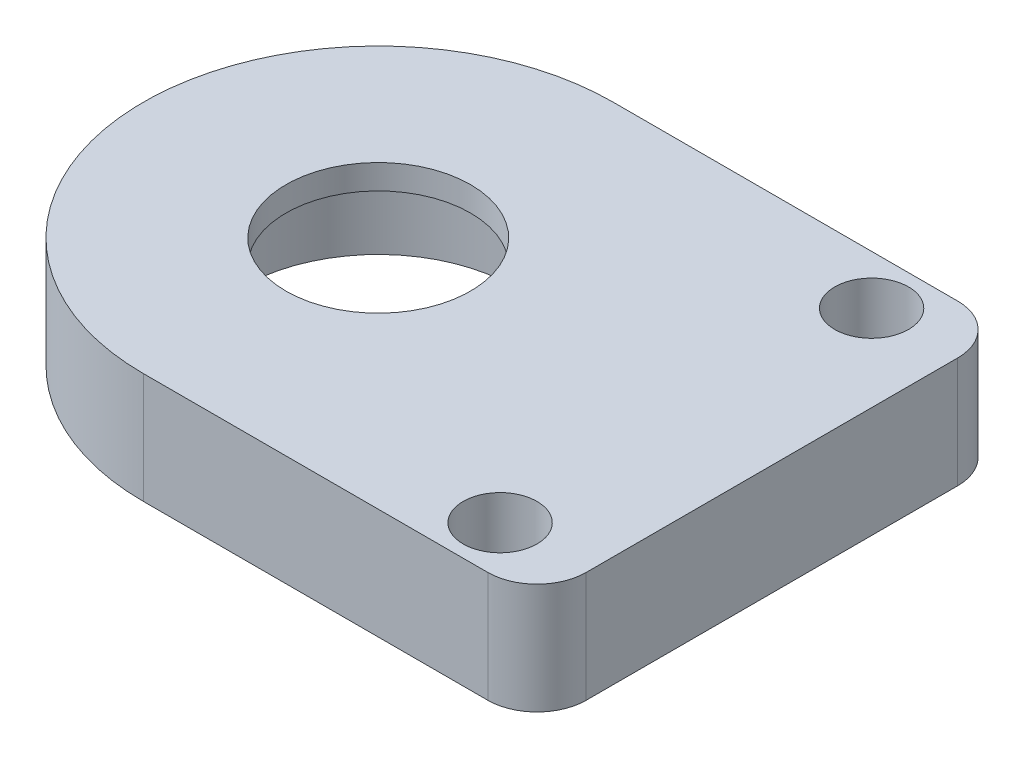
from build123d import *

# Parameters (mm, degrees)
SKIZZE1_R                       = 1.6
SKIZZE1_R_2                     = 11.075
AUFSATZ_LINEAR_AUSTRAGEN1_DEPTH = 7
SKIZZE3_R                       = 7.5
AUFSATZ_LINEAR_AUSTRAGEN2_DEPTH = 2
SKIZZE4_R                       = 3
SCHNITT_LINEAR_AUSTRAGEN1_DEPTH = 6.5
VERRUNDUNG4_R                   = 4


with BuildPart() as part:
    # Skizze1 → Aufsatz-Linear austragen1 (new body)
    with BuildSketch(Plane(origin=(0, 0, 0), x_dir=(1, 0, 0), z_dir=(0, 1, 0))):
        with BuildLine():
            Line((0, 19.098593171), (32, 19.098593171))
            Line((32, 19.098593171), (32, -19.098593171))
            Line((32, -19.098593171), (0, -19.098593171))
            ThreePointArc((0, -19.098593171), (-19.098593171, 0), (0, 19.098593171))
        make_face()
        with Locations(Location((25, -15.098593171, 0), (0, 0, 270))):
            Circle(SKIZZE1_R, mode=Mode.SUBTRACT)
        with Locations(Location((25, 15.098593171, 0), (0, 0, 90))):
            Circle(SKIZZE1_R, mode=Mode.SUBTRACT)
        with Locations(Location((0, 0, 0), (0, 0, 270))):
            Circle(SKIZZE1_R_2, mode=Mode.SUBTRACT)
    extrude(amount=AUFSATZ_LINEAR_AUSTRAGEN1_DEPTH)

    # Skizze3 → Aufsatz-Linear austragen2 (add)
    with BuildSketch(Plane(origin=(0, 7, 0), x_dir=(1, 0, 0), z_dir=(0, 1, 0))):
        with BuildLine():
            Line((0, 19.098593171), (32, 19.098593171))
            Line((32, 19.098593171), (32, -19.098593171))
            Line((32, -19.098593171), (0, -19.098593171))
            ThreePointArc((0, -19.098593171), (-19.098593171, 0), (0, 19.098593171))
        make_face()
        with Locations(Location((0, 0, 0), (0, 0, 270))):
            Circle(SKIZZE3_R, mode=Mode.SUBTRACT)
    extrude(amount=AUFSATZ_LINEAR_AUSTRAGEN2_DEPTH)

    # Skizze4 → Schnitt-Linear austragen1 (cut)
    with BuildSketch(Plane(origin=(0, 9, 0), x_dir=(1, 0, 0), z_dir=(0, 1, 0))):
        with Locations(Location((25, 15.098593171, 0), (0, 0, 270))):
            Circle(SKIZZE4_R)
        with Locations(Location((25, -15.098593171, 0), (0, 0, 270))):
            Circle(SKIZZE4_R)
    extrude(amount=-SCHNITT_LINEAR_AUSTRAGEN1_DEPTH, mode=Mode.SUBTRACT)

    # Verrundung4
    verrundung4_edges = [part.edges().sort_by_distance(p)[0] for p in [
        (32, 4.5, -19.098593171),
        (32, 4.5, 19.098593171),
    ]]
    fillet(verrundung4_edges, radius=VERRUNDUNG4_R)


solid = part.part
